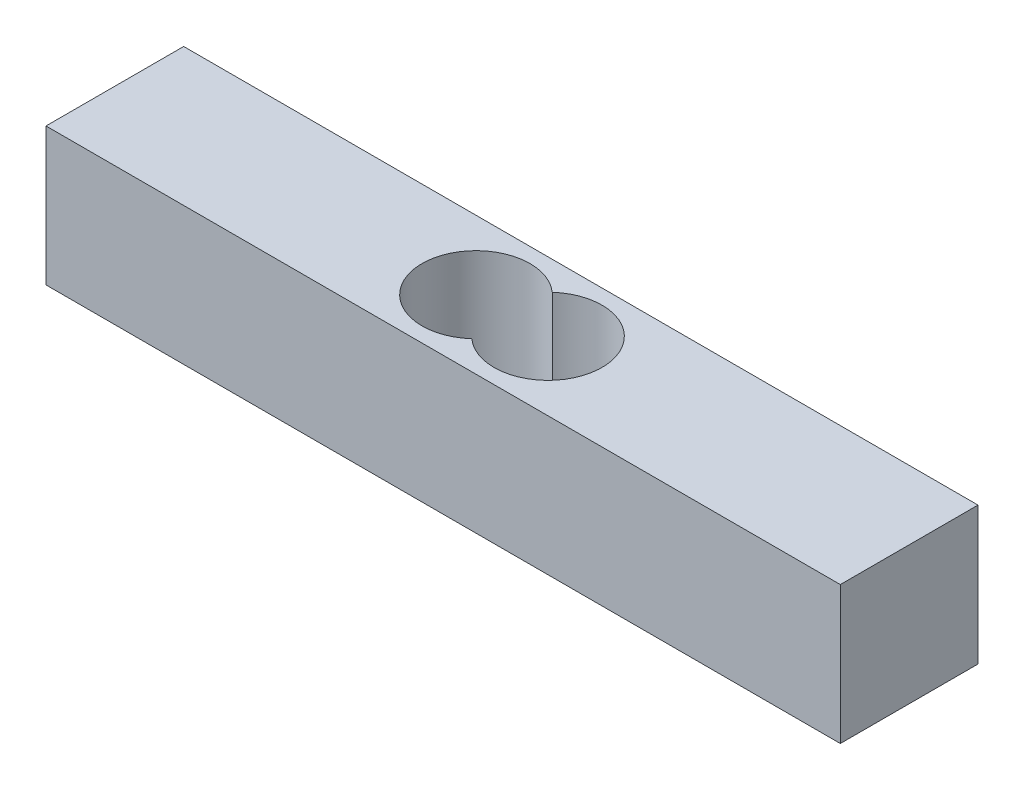
from build123d import *

# Parameters (mm, degrees)
SKETCH1_W           = 75
SKETCH1_H           = 13
BOSS_EXTRUDE1_DEPTH = 13


with BuildPart() as part:
    # Sketch1 → Boss-Extrude1 (new body)
    with BuildSketch(Plane(origin=(0, 0, 0), x_dir=(1, 0, 0), z_dir=(0, 1, 0))):
        Rectangle(SKETCH1_W, SKETCH1_H)
        with BuildLine():
            ThreePointArc((0, 3.801315562), (-8.5, 0), (0, -3.801315562))
            ThreePointArc((0, -3.801315562), (8.5, 0), (0, 3.801315562))
        make_face(mode=Mode.SUBTRACT)
    extrude(amount=BOSS_EXTRUDE1_DEPTH)


solid = part.part
